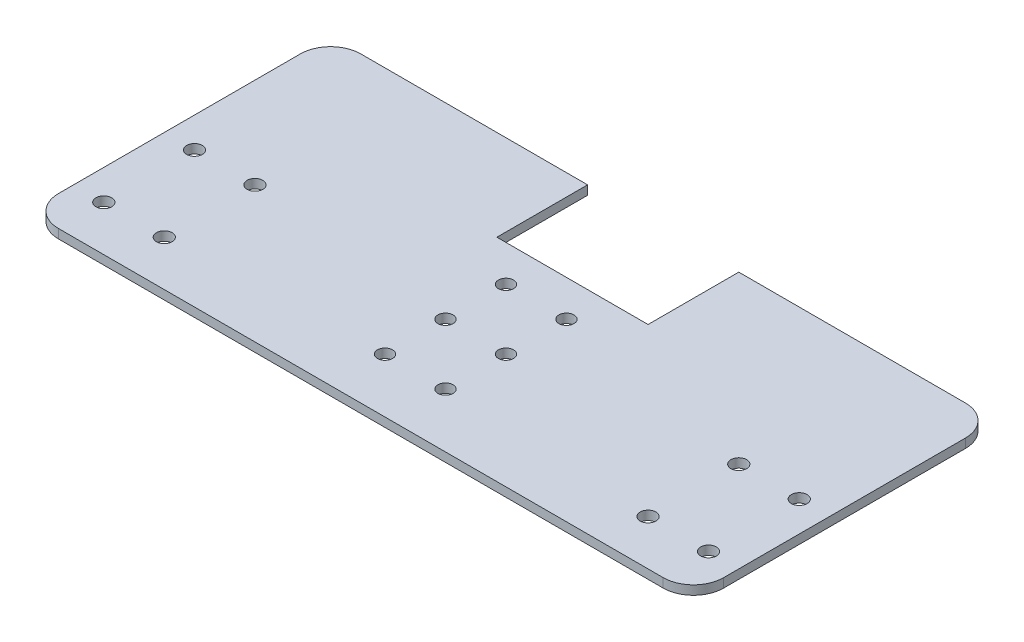
from build123d import *

# Parameters (mm, degrees)
EXTRUDE_268_DEPTH      = 3
SKETCH_2_W             = 50
SKETCH_2_H             = 30
CUT_EXTRUDE_486_DEPTH  = 121.867696263
SKETCH_3_R             = 2.5
CUT_EXTRUDE_744_DEPTH  = 121.867696263
SKETCH_4_R             = 2.6
CUT_EXTRUDE_1056_DEPTH = 121.867696263


with BuildPart() as part:
    # 草图1 → Extrude 268 (new body)
    with BuildSketch(Plane(origin=(0, 0, 0), x_dir=(1, 0, 0), z_dir=(0, 1, 0))):
        with BuildLine():
            Line((-100, 50), (100, 50))
            ThreePointArc((100, 50), (107.071067812, 47.071067812), (110, 40))
            Line((110, 40), (110, -40))
            ThreePointArc((110, -40), (107.071067812, -47.071067812), (100, -50))
            Line((100, -50), (-100, -50))
            ThreePointArc((-100, -50), (-107.071067812, -47.071067812), (-110, -40))
            Line((-110, -40), (-110, 40))
            ThreePointArc((-110, 40), (-107.071067812, 47.071067812), (-100, 50))
        make_face()
    extrude(amount=EXTRUDE_268_DEPTH)

    # 草图2 → Cut-Extrude 486 (cut, through all)
    with BuildSketch(Plane(origin=(0, 3, 0), x_dir=(1, 0, 0), z_dir=(0, 1, 0))):
        with Locations((0, 35)):
            Rectangle(SKETCH_2_W, SKETCH_2_H)
    extrude(amount=-CUT_EXTRUDE_486_DEPTH, mode=Mode.SUBTRACT)

    # 草图3 → Cut-Extrude 744 (cut, through all)
    with BuildSketch(Plane(origin=(0, 3, 0), x_dir=(1, 0, 0), z_dir=(0, 1, 0))):
        with Locations(Location((10, 8, 0), (0, 0, 270))):
            Circle(SKETCH_3_R)
        with Locations(Location((10, -12, 0), (0, 0, 270))):
            Circle(SKETCH_3_R)
        with Locations(Location((10, -32, 0), (0, 0, 270))):
            Circle(SKETCH_3_R)
        with Locations(Location((-10, -32, 0), (0, 0, 270))):
            Circle(SKETCH_3_R)
        with Locations(Location((-10, -12, 0), (0, 0, 270))):
            Circle(SKETCH_3_R)
        with Locations(Location((-10, 8, 0), (0, 0, 270))):
            Circle(SKETCH_3_R)
    extrude(amount=-CUT_EXTRUDE_744_DEPTH, mode=Mode.SUBTRACT)

    # 草图4 → Cut-Extrude 1056 (cut, through all)
    with BuildSketch(Plane(origin=(0, 3, 0), x_dir=(1, 0, 0), z_dir=(0, 1, 0))):
        with Locations(Location((100, -35, 0), (0, 0, 270))):
            Circle(SKETCH_4_R)
        with Locations(Location((80, -35, 0), (0, 0, 270))):
            Circle(SKETCH_4_R)
        with Locations(Location((100, -5, 0), (0, 0, 270))):
            Circle(SKETCH_4_R)
        with Locations(Location((80, -5, 0), (0, 0, 270))):
            Circle(SKETCH_4_R)
        with Locations(Location((-100, -35, 0), (0, 0, 270))):
            Circle(SKETCH_4_R)
        with Locations(Location((-100, -5, 0), (0, 0, 270))):
            Circle(SKETCH_4_R)
        with Locations(Location((-80, -35, 0), (0, 0, 270))):
            Circle(SKETCH_4_R)
        with Locations(Location((-80, -5, 0), (0, 0, 270))):
            Circle(SKETCH_4_R)
    extrude(amount=-CUT_EXTRUDE_1056_DEPTH, mode=Mode.SUBTRACT)


solid = part.part
